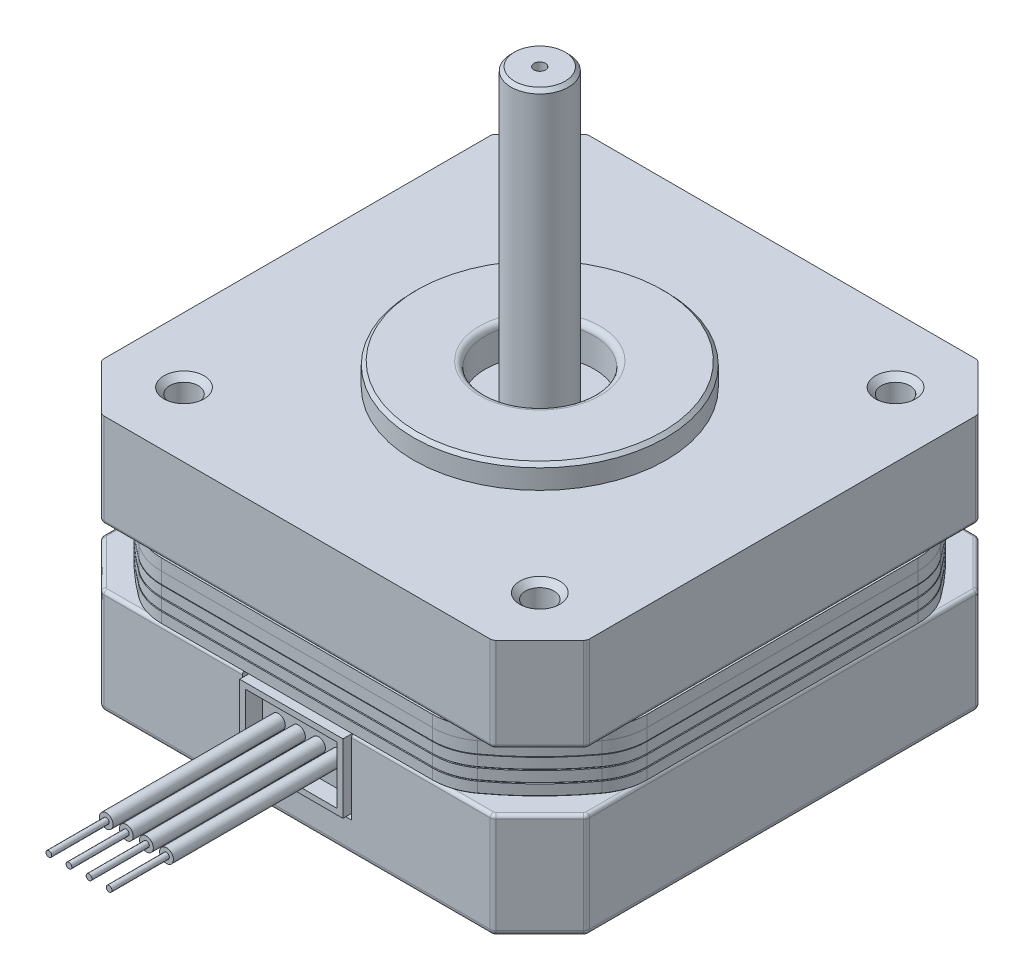
from build123d import *

# Parameters (mm, degrees)
EXTRUDE_1_DEPTH        = 9.2
EXTRUDE_START          = 22.4
EXTRUDE_2_DEPTH        = 8.2
EXTRUDE_3_DEPTH        = 1
PATTERN_LINEAR_1_COUNT = 5
PATTERN_LINEAR_1_PITCH = 1
SKETCH_3_R             = 4.75
CUT_EXTRUDE_1_DEPTH    = 3
SKETCH_4_R             = 4.75
SKETCH_4_R_2           = 2.5
CUT_EXTRUDE_2_DEPTH    = 0.5
SKETCH_5_R             = 0.5
CUT_EXTRUDE_3_DEPTH    = 0.5
CHAMFER_1_SIZE         = 0.3
FILLET_1_R             = 0.5
FILLET_2_R             = 0.5
SKETCH_6_R             = 11
SKETCH_6_R_2           = 4.75
EXTRUDE_4_DEPTH        = 2
CUT_EXTRUDE_START      = -1
SKETCH_7_R             = 4.75
CUT_EXTRUDE_4_DEPTH    = 1
CHAMFER_2_SIZE         = 0.3
FILLET_3_R             = 0.5
SKETCH_8_R             = 2.5
EXTRUDE_5_DEPTH        = 25.2
CHAMFER_4_SIZE         = 0.3
SKETCH_9_R             = 0.5
CUT_EXTRUDE_5_DEPTH    = 1
SKETCH_10_W            = 9.5
SKETCH_10_H            = 6.5
CUT_EXTRUDE_6_DEPTH    = 1
SKETCH_11_W            = 9
SKETCH_11_H            = 6
SKETCH_11_W_2          = 8
SKETCH_11_H_2          = 5
EXTRUDE_6_DEPTH        = 1.5
SKETCH_12_R            = 0.6
SKETCH_12_R_2          = 0.25
EXTRUDE_7_DEPTH        = 15
EXTRUDE_7_2_DEPTH      = 15
EXTRUDE_7_3_DEPTH      = 15
EXTRUDE_7_4_DEPTH      = 15
SKETCH_12_2_R          = 0.25
EXTRUDE_8_DEPTH        = 20
EXTRUDE_8_2_DEPTH      = 20
EXTRUDE_8_3_DEPTH      = 20
EXTRUDE_8_4_DEPTH      = 20
CHAMFER_32_SIZE        = 0.05
CHAMFER_33_SIZE        = 0.05
CHAMFER_34_SIZE        = 0.05
SKETCH_16_R            = 1.25
CUT_EXTRUDE_9_DEPTH    = 7
CHAMFER_35_SIZE        = 0.5
FILLET_4_R             = 0.3
FILLET_5_R             = 0.3


with BuildPart() as part:
    # Эскиз1 → Бобышка-Вытянуть1 (new body)
    with BuildSketch(Plane(origin=(0, 0, 0), x_dir=(1, 0, 0), z_dir=(0, 1, 0))):
        Polygon((-17.033766184, 21.15), (-21.15, 17.033766184), (-21.15, -17.033766184), (-17.033766184, -21.15), (17.033766184, -21.15), (21.15, -17.033766184), (21.15, 17.033766184), (17.033766184, 21.15), align=None)
    extrude(amount=EXTRUDE_1_DEPTH)

    # Эскиз3 → Вырез-Вытянуть1 (cut)
    with BuildSketch(Plane.XZ):
        with Locations(Location((0, 0, 0), (0, 0, 270))):
            Circle(SKETCH_3_R)
    extrude(amount=-CUT_EXTRUDE_1_DEPTH, mode=Mode.SUBTRACT)

    # Эскиз4 → Вырез-Вытянуть2 (cut)
    with BuildSketch(Plane.XZ.offset(-3)):
        with Locations(Location((0, 0, 0), (0, 0, 270))):
            Circle(SKETCH_4_R)
        with Locations(Location((0, 0, 0), (0, 0, 270))):
            Circle(SKETCH_4_R_2, mode=Mode.SUBTRACT)
    extrude(amount=-CUT_EXTRUDE_2_DEPTH, mode=Mode.SUBTRACT)

    # Эскиз5 → Вырез-Вытянуть3 (cut)
    with BuildSketch(Plane.XZ.offset(-3)):
        with Locations(Location((0, 0, 0), (0, 0, 270))):
            Circle(SKETCH_5_R)
    extrude(amount=-CUT_EXTRUDE_3_DEPTH, mode=Mode.SUBTRACT)

    # Фаска1
    chamfer_1_edges = [part.edges().sort_by_distance(p)[0] for p in [
        (0, 3, 2.5),
    ]]
    chamfer(chamfer_1_edges, length=CHAMFER_1_SIZE)

    # Скругление1
    fillet_1_edges = [part.edges().sort_by_distance(p)[0] for p in [
        (0, 0, -21.15),
        (19.091883092, 0, -19.091883092),
        (21.15, 0, 0),
        (19.091883092, 0, 19.091883092),
        (0, 0, 21.15),
        (-19.091883092, 0, 19.091883092),
        (-21.15, 4.6, 17.033766184),
        (-21.15, 4.6, -17.033766184),
        (-17.033766184, 4.6, -21.15),
        (17.033766184, 4.6, -21.15),
        (21.15, 4.6, -17.033766184),
        (21.15, 4.6, 17.033766184),
        (17.033766184, 4.6, 21.15),
        (-17.033766184, 4.6, 21.15),
        (0, 0, 4.75),
        (-21.15, 0, 0),
        (-19.091883092, 0, -19.091883092),
    ]]
    fillet(fillet_1_edges, radius=FILLET_1_R)

    # Эскиз10 → Вырез-Вытянуть6 (cut)
    with BuildSketch(Plane.XY.offset(21.15)):
        with Locations((0, 5.95)):
            Rectangle(SKETCH_10_W, SKETCH_10_H)
    extrude(amount=-CUT_EXTRUDE_6_DEPTH, mode=Mode.SUBTRACT)

    # Скругление4
    fillet_4_edges = [part.edges().sort_by_distance(p)[0] for p in [
        (10.788329701, 9.2, 21.15),
        (-10.788329701, 9.2, 21.15),
        (19.091883092, 9.2, 19.091883092),
        (21.15, 9.2, 0),
        (19.091883092, 9.2, -19.091883092),
        (0, 9.2, -21.15),
        (-19.091883092, 9.2, -19.091883092),
        (-21.15, 9.2, 0),
        (-19.091883092, 9.2, 19.091883092),
        (21.111939766, 9.2, -17.018001119),
        (17.018001119, 9.2, -21.111939766),
        (-17.018001119, 9.2, -21.111939766),
        (-21.111939766, 9.2, -17.018001119),
        (-21.111939766, 9.2, 17.018001119),
        (-17.018001119, 9.2, 21.111939766),
        (17.018001119, 9.2, 21.111939766),
        (21.111939766, 9.2, 17.018001119),
    ]]
    fillet(fillet_4_edges, radius=FILLET_4_R)


with BuildPart() as body_2:
    # Эскиз1<3> → Бобышка-Вытянуть2 (new body)
    with BuildSketch(Plane(origin=(0, 0, 0), x_dir=(1, 0, 0), z_dir=(0, 1, 0)).offset(EXTRUDE_START)):
        Polygon((-17.033766184, 21.15), (-21.15, 17.033766184), (-21.15, -17.033766184), (-17.033766184, -21.15), (17.033766184, -21.15), (21.15, -17.033766184), (21.15, 17.033766184), (17.033766184, 21.15), align=None)
    extrude(amount=-EXTRUDE_2_DEPTH)

    # Скругление2
    fillet_2_edges = [body_2.edges().sort_by_distance(p)[0] for p in [
        (-21.15, 18.3, 17.033766184),
        (-21.15, 18.3, -17.033766184),
        (-17.033766184, 18.3, -21.15),
        (17.033766184, 18.3, -21.15),
        (21.15, 18.3, -17.033766184),
        (21.15, 18.3, 17.033766184),
        (17.033766184, 18.3, 21.15),
        (-17.033766184, 18.3, 21.15),
    ]]
    fillet(fillet_2_edges, radius=FILLET_2_R)

    # Эскиз6 → Бобышка-Вытянуть4 (add)
    with BuildSketch(Plane(origin=(0, 22.4, 0), x_dir=(1, 0, 0), z_dir=(0, 1, 0))):
        with Locations(Location((0, 0, 0), (0, 0, 270))):
            Circle(SKETCH_6_R)
        with Locations(Location((0, 0, 0), (0, 0, 270))):
            Circle(SKETCH_6_R_2, mode=Mode.SUBTRACT)
    extrude(amount=EXTRUDE_4_DEPTH)

    # Эскиз7 → Вырез-Вытянуть4 (cut)
    with BuildSketch(Plane(origin=(0, 22.4, 0), x_dir=(1, 0, 0), z_dir=(0, 1, 0)).offset(CUT_EXTRUDE_START)):
        with Locations(Location((0, 0, 0), (0, 0, 270))):
            Circle(SKETCH_7_R)
    extrude(amount=CUT_EXTRUDE_4_DEPTH, mode=Mode.SUBTRACT)

    # Фаска2
    chamfer_2_edges = [body_2.edges().sort_by_distance(p)[0] for p in [
        (0, 24.4, -11),
    ]]
    chamfer(chamfer_2_edges, length=CHAMFER_2_SIZE)

    # Скругление3
    fillet_3_edges = [body_2.edges().sort_by_distance(p)[0] for p in [
        (0, 24.4, -4.75),
    ]]
    fillet(fillet_3_edges, radius=FILLET_3_R)

    # Эскиз8 → Бобышка-Вытянуть5 (add)
    with BuildSketch(Plane(origin=(0, 21.4, 0), x_dir=(1, 0, 0), z_dir=(0, 1, 0))):
        with Locations(Location((0, 0, 0), (0, 0, 270))):
            Circle(SKETCH_8_R)
    extrude(amount=EXTRUDE_5_DEPTH)

    # Фаска4
    chamfer_4_edges = [body_2.edges().sort_by_distance(p)[0] for p in [
        (0, 46.6, -2.5),
    ]]
    chamfer(chamfer_4_edges, length=CHAMFER_4_SIZE)

    # Эскиз9 → Вырез-Вытянуть5 (cut)
    with BuildSketch(Plane(origin=(0, 46.6, 0), x_dir=(1, 0, 0), z_dir=(0, 1, 0)).offset(CUT_EXTRUDE_START)):
        with Locations(Location((0, 0, 0), (0, 0, 270))):
            Circle(SKETCH_9_R)
    extrude(amount=CUT_EXTRUDE_5_DEPTH, mode=Mode.SUBTRACT)

    # Эскиз16 → Вырез-Вытянуть9 (cut)
    with BuildSketch(Plane(origin=(0, 22.4, 0), x_dir=(1, 0, 0), z_dir=(0, 1, 0))):
        with Locations(Location((-15.5, 15.5, 0), (0, 0, 270))):
            Circle(SKETCH_16_R)
        with Locations(Location((15.5, 15.5, 0), (0, 0, 270))):
            Circle(SKETCH_16_R)
        with Locations(Location((15.5, -15.5, 0), (0, 0, 270))):
            Circle(SKETCH_16_R)
        with Locations(Location((-15.5, -15.5, 0), (0, 0, 270))):
            Circle(SKETCH_16_R)
    extrude(amount=-CUT_EXTRUDE_9_DEPTH, mode=Mode.SUBTRACT)

    # Фаска35
    chamfer_35_edges = [body_2.edges().sort_by_distance(p)[0] for p in [
        (-15.5, 22.4, -16.75),
        (15.5, 22.4, -16.75),
        (15.5, 22.4, 14.25),
        (-15.5, 22.4, 14.25),
    ]]
    chamfer(chamfer_35_edges, length=CHAMFER_35_SIZE)

    # Скругление5
    fillet_5_edges = [body_2.edges().sort_by_distance(p)[0] for p in [
        (19.091883092, 14.2, 19.091883092),
        (21.15, 14.2, 0),
        (-19.091883092, 14.2, 19.091883092),
        (-21.15, 14.2, 0),
        (-19.091883092, 14.2, -19.091883092),
        (0, 14.2, -21.15),
        (19.091883092, 14.2, -19.091883092),
        (0, 14.2, 21.15),
        (21.111939766, 14.2, -17.018001119),
        (17.018001119, 14.2, -21.111939766),
        (-17.018001119, 14.2, -21.111939766),
        (-21.111939766, 14.2, -17.018001119),
        (-21.111939766, 14.2, 17.018001119),
        (-17.018001119, 14.2, 21.111939766),
        (17.018001119, 14.2, 21.111939766),
        (21.111939766, 14.2, 17.018001119),
    ]]
    fillet(fillet_5_edges, radius=FILLET_5_R)


with BuildPart() as body_3:
    # Эскиз2 → Бобышка-Вытянуть3 (new body)
    with BuildSketch(Plane(origin=(0, 9.2, 0), x_dir=(1, 0, 0), z_dir=(0, 1, 0))):
        with BuildLine():
            Line((-11.797351398, -21.15), (11.797351398, -21.15))
            ThreePointArc((11.797351398, -21.15), (13.348560603, -20.903288335), (14.746689247, -20.1875))
            ThreePointArc((14.746689247, -20.1875), (17.67766953, -17.67766953), (20.1875, -14.746689247))
            ThreePointArc((20.1875, -14.746689247), (20.903288335, -13.348560603), (21.15, -11.797351398))
            Line((21.15, -11.797351398), (21.15, 11.797351398))
            ThreePointArc((21.15, 11.797351398), (20.903288335, 13.348560603), (20.1875, 14.746689247))
            ThreePointArc((20.1875, 14.746689247), (17.67766953, 17.67766953), (14.746689247, 20.1875))
            ThreePointArc((14.746689247, 20.1875), (13.348560603, 20.903288335), (11.797351398, 21.15))
            Line((11.797351398, 21.15), (-11.797351398, 21.15))
            ThreePointArc((-11.797351398, 21.15), (-13.348560603, 20.903288335), (-14.746689247, 20.1875))
            ThreePointArc((-14.746689247, 20.1875), (-17.67766953, 17.67766953), (-20.1875, 14.746689247))
            ThreePointArc((-20.1875, 14.746689247), (-20.903288335, 13.348560603), (-21.15, 11.797351398))
            Line((-21.15, 11.797351398), (-21.15, -11.797351398))
            ThreePointArc((-21.15, -11.797351398), (-20.903288335, -13.348560603), (-20.1875, -14.746689247))
            ThreePointArc((-20.1875, -14.746689247), (-17.67766953, -17.67766953), (-14.746689247, -20.1875))
            ThreePointArc((-14.746689247, -20.1875), (-13.348560603, -20.903288335), (-11.797351398, -21.15))
        make_face()
    extrude(amount=EXTRUDE_3_DEPTH)


with BuildPart() as pattern_linear_1_1:
    # Линейный массив1: pattern copy
    add(body_3.part.moved(Location(Vector(0, 1, 0) * (1 * PATTERN_LINEAR_1_PITCH))))

    # Фаска33
    chamfer_33_edges = [pattern_linear_1_1.edges().sort_by_distance(p)[0] for p in [
        (-13.348560603, 11.2, -20.903288335),
        (-17.67766953, 11.2, -17.67766953),
        (17.67766953, 10.2, -17.67766953),
        (20.903288335, 10.2, -13.348560603),
        (21.15, 10.2, 0),
        (20.903288335, 10.2, 13.348560603),
        (17.67766953, 10.2, 17.67766953),
        (-20.903288335, 11.2, -13.348560603),
        (13.348560603, 10.2, 20.903288335),
        (0, 10.2, 21.15),
        (-13.348560603, 10.2, 20.903288335),
        (-17.67766953, 10.2, 17.67766953),
        (-20.903288335, 10.2, 13.348560603),
        (-21.15, 10.2, 0),
        (-20.903288335, 10.2, -13.348560603),
        (-17.67766953, 10.2, -17.67766953),
        (-21.15, 11.2, 0),
        (-13.348560603, 10.2, -20.903288335),
        (0, 10.2, -21.15),
        (13.348560603, 10.2, -20.903288335),
        (-20.903288335, 11.2, 13.348560603),
        (-17.67766953, 11.2, 17.67766953),
        (-13.348560603, 11.2, 20.903288335),
        (0, 11.2, 21.15),
        (13.348560603, 11.2, 20.903288335),
        (17.67766953, 11.2, 17.67766953),
        (13.348560603, 11.2, -20.903288335),
        (20.903288335, 11.2, 13.348560603),
        (21.15, 11.2, 0),
        (20.903288335, 11.2, -13.348560603),
        (17.67766953, 11.2, -17.67766953),
        (0, 11.2, -21.15),
    ]]
    chamfer(chamfer_33_edges, length=CHAMFER_33_SIZE)


with BuildPart() as pattern_linear_1_2:
    # Линейный массив1: pattern copy
    add(body_3.part.moved(Location(Vector(0, 1, 0) * (2 * PATTERN_LINEAR_1_PITCH))))

    # Фаска32
    chamfer_32_edges = [pattern_linear_1_2.edges().sort_by_distance(p)[0] for p in [
        (-13.348560603, 12.2, -20.903288335),
        (-17.67766953, 12.2, -17.67766953),
        (17.67766953, 11.2, -17.67766953),
        (20.903288335, 11.2, -13.348560603),
        (21.15, 11.2, 0),
        (20.903288335, 11.2, 13.348560603),
        (17.67766953, 11.2, 17.67766953),
        (-20.903288335, 12.2, -13.348560603),
        (13.348560603, 11.2, 20.903288335),
        (0, 11.2, 21.15),
        (-13.348560603, 11.2, 20.903288335),
        (-17.67766953, 11.2, 17.67766953),
        (-20.903288335, 11.2, 13.348560603),
        (-21.15, 11.2, 0),
        (-20.903288335, 11.2, -13.348560603),
        (-17.67766953, 11.2, -17.67766953),
        (-21.15, 12.2, 0),
        (-13.348560603, 11.2, -20.903288335),
        (0, 11.2, -21.15),
        (13.348560603, 11.2, -20.903288335),
        (-20.903288335, 12.2, 13.348560603),
        (-17.67766953, 12.2, 17.67766953),
        (-13.348560603, 12.2, 20.903288335),
        (0, 12.2, 21.15),
        (13.348560603, 12.2, 20.903288335),
        (17.67766953, 12.2, 17.67766953),
        (13.348560603, 12.2, -20.903288335),
        (20.903288335, 12.2, 13.348560603),
        (21.15, 12.2, 0),
        (20.903288335, 12.2, -13.348560603),
        (17.67766953, 12.2, -17.67766953),
        (0, 12.2, -21.15),
    ]]
    chamfer(chamfer_32_edges, length=CHAMFER_32_SIZE)


with BuildPart() as pattern_linear_1_3:
    # Линейный массив1: pattern copy
    add(body_3.part.moved(Location(Vector(0, 1, 0) * (3 * PATTERN_LINEAR_1_PITCH))))


with BuildPart() as pattern_linear_1_4:
    # Линейный массив1: pattern copy
    add(body_3.part.moved(Location(Vector(0, 1, 0) * (4 * PATTERN_LINEAR_1_PITCH))))


with BuildPart() as body_8:
    # Эскиз11 → Бобышка-Вытянуть6 (new body)
    with BuildSketch(Plane.XY.offset(20.15)):
        with Locations((0, 5.95)):
            Rectangle(SKETCH_11_W, SKETCH_11_H)
        with Locations((0, 5.95)):
            Rectangle(SKETCH_11_W_2, SKETCH_11_H_2, mode=Mode.SUBTRACT)
    extrude(amount=EXTRUDE_6_DEPTH)


with BuildPart() as body_9:
    # Эскиз12 → Бобышка-Вытянуть7 (new body)
    with BuildSketch(Plane.XY.offset(20.15)):
        with Locations((-2.625, 5.95)):
            Circle(SKETCH_12_R)
        with Locations((-2.625, 5.95)):
            Circle(SKETCH_12_R_2, mode=Mode.SUBTRACT)
    extrude(amount=EXTRUDE_7_DEPTH)


with BuildPart() as body_10:
    # Эскиз12 → Extrude 7 2 (new body)
    with BuildSketch(Plane.XY.offset(20.15)):
        with Locations((-0.875, 5.95)):
            Circle(SKETCH_12_R)
        with Locations((-0.875, 5.95)):
            Circle(SKETCH_12_R_2, mode=Mode.SUBTRACT)
    extrude(amount=EXTRUDE_7_2_DEPTH)


with BuildPart() as body_11:
    # Эскиз12 → Extrude 7 3 (new body)
    with BuildSketch(Plane.XY.offset(20.15)):
        with Locations((0.875, 5.95)):
            Circle(SKETCH_12_R)
        with Locations((0.875, 5.95)):
            Circle(SKETCH_12_R_2, mode=Mode.SUBTRACT)
    extrude(amount=EXTRUDE_7_3_DEPTH)


with BuildPart() as body_12:
    # Эскиз12 → Extrude 7 4 (new body)
    with BuildSketch(Plane.XY.offset(20.15)):
        with Locations((2.625, 5.95)):
            Circle(SKETCH_12_R)
        with Locations((2.625, 5.95)):
            Circle(SKETCH_12_R_2, mode=Mode.SUBTRACT)
    extrude(amount=EXTRUDE_7_4_DEPTH)


with BuildPart() as body_13:
    # Эскиз12<2> → Бобышка-Вытянуть8 (new body)
    with BuildSketch(Plane.XY.offset(20.15)):
        with Locations((-2.625, 5.95)):
            Circle(SKETCH_12_2_R)
    extrude(amount=EXTRUDE_8_DEPTH)


with BuildPart() as body_14:
    # Эскиз12<2> → Extrude 8 2 (new body)
    with BuildSketch(Plane.XY.offset(20.15)):
        with Locations((-0.875, 5.95)):
            Circle(SKETCH_12_2_R)
    extrude(amount=EXTRUDE_8_2_DEPTH)


with BuildPart() as body_15:
    # Эскиз12<2> → Extrude 8 3 (new body)
    with BuildSketch(Plane.XY.offset(20.15)):
        with Locations((0.875, 5.95)):
            Circle(SKETCH_12_2_R)
    extrude(amount=EXTRUDE_8_3_DEPTH)


with BuildPart() as body_16:
    # Эскиз12<2> → Extrude 8 4 (new body)
    with BuildSketch(Plane.XY.offset(20.15)):
        with Locations((2.625, 5.95)):
            Circle(SKETCH_12_2_R)
    extrude(amount=EXTRUDE_8_4_DEPTH)


with BuildPart() as body_3_1:
    add(body_3.part)

    # Фаска34
    chamfer_34_edges = [body_3_1.edges().sort_by_distance(p)[0] for p in [
        (-13.348560603, 10.2, -20.903288335),
        (-17.67766953, 10.2, -17.67766953),
        (17.67766953, 9.2, -17.67766953),
        (20.903288335, 9.2, -13.348560603),
        (21.15, 9.2, 0),
        (20.903288335, 9.2, 13.348560603),
        (17.67766953, 9.2, 17.67766953),
        (-20.903288335, 10.2, -13.348560603),
        (13.348560603, 9.2, 20.903288335),
        (0, 9.2, 21.15),
        (-13.348560603, 9.2, 20.903288335),
        (-17.67766953, 9.2, 17.67766953),
        (-20.903288335, 9.2, 13.348560603),
        (-21.15, 9.2, 0),
        (-20.903288335, 9.2, -13.348560603),
        (-17.67766953, 9.2, -17.67766953),
        (-21.15, 10.2, 0),
        (-13.348560603, 9.2, -20.903288335),
        (0, 9.2, -21.15),
        (13.348560603, 9.2, -20.903288335),
        (-20.903288335, 10.2, 13.348560603),
        (-17.67766953, 10.2, 17.67766953),
        (-13.348560603, 10.2, 20.903288335),
        (0, 10.2, 21.15),
        (13.348560603, 10.2, 20.903288335),
        (17.67766953, 10.2, 17.67766953),
        (13.348560603, 10.2, -20.903288335),
        (20.903288335, 10.2, 13.348560603),
        (21.15, 10.2, 0),
        (20.903288335, 10.2, -13.348560603),
        (17.67766953, 10.2, -17.67766953),
        (0, 10.2, -21.15),
    ]]
    chamfer(chamfer_34_edges, length=CHAMFER_34_SIZE)


solid = Compound([part.part, body_2.part, pattern_linear_1_1.part, pattern_linear_1_2.part, pattern_linear_1_3.part, pattern_linear_1_4.part, body_8.part, body_9.part, body_10.part, body_11.part, body_12.part, body_13.part, body_14.part, body_15.part, body_16.part, body_3_1.part])
